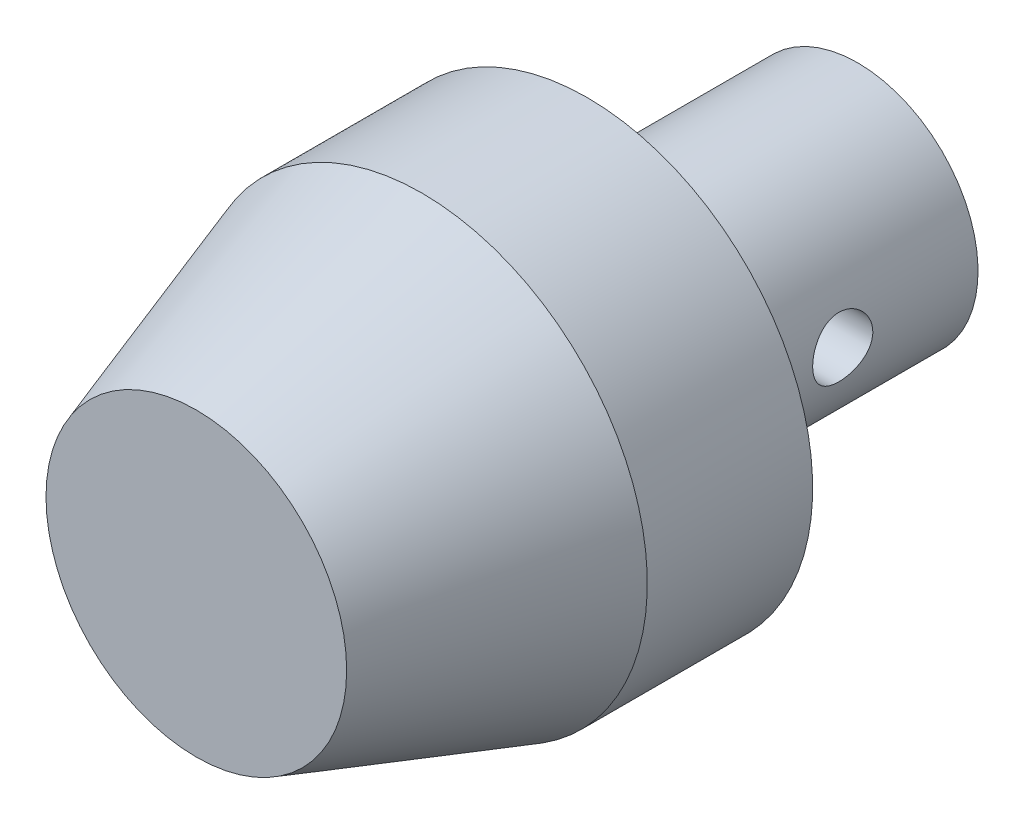
from build123d import *

# Parameters (mm, degrees)
SKETCH_2_R          = 2
CUT_EXTRUDE_1_DEPTH = 10


with BuildPart() as part:
    # 草圖1 → 旋轉1 (revolve)
    with BuildSketch(Plane(origin=(0, 0, 0), x_dir=(0, 0, -1), z_dir=(1, 0, 0))):
        Polygon((0, 0), (0, 10), (15, 15), (26, 15), (26, 8), (44, 8), (44, 0), align=None)
    revolve(axis=Axis((0, 0, -44), (0, 0, 1)))

    # 草圖2 → 除料-伸長1 (cut, symmetric)
    with BuildSketch(Plane(origin=(0, 0, 0), x_dir=(0, 0, -1), z_dir=(1, 0, 0))):
        with Locations((35, 0)):
            Circle(SKETCH_2_R)
    extrude(amount=CUT_EXTRUDE_1_DEPTH, both=True, mode=Mode.SUBTRACT)


solid = part.part
